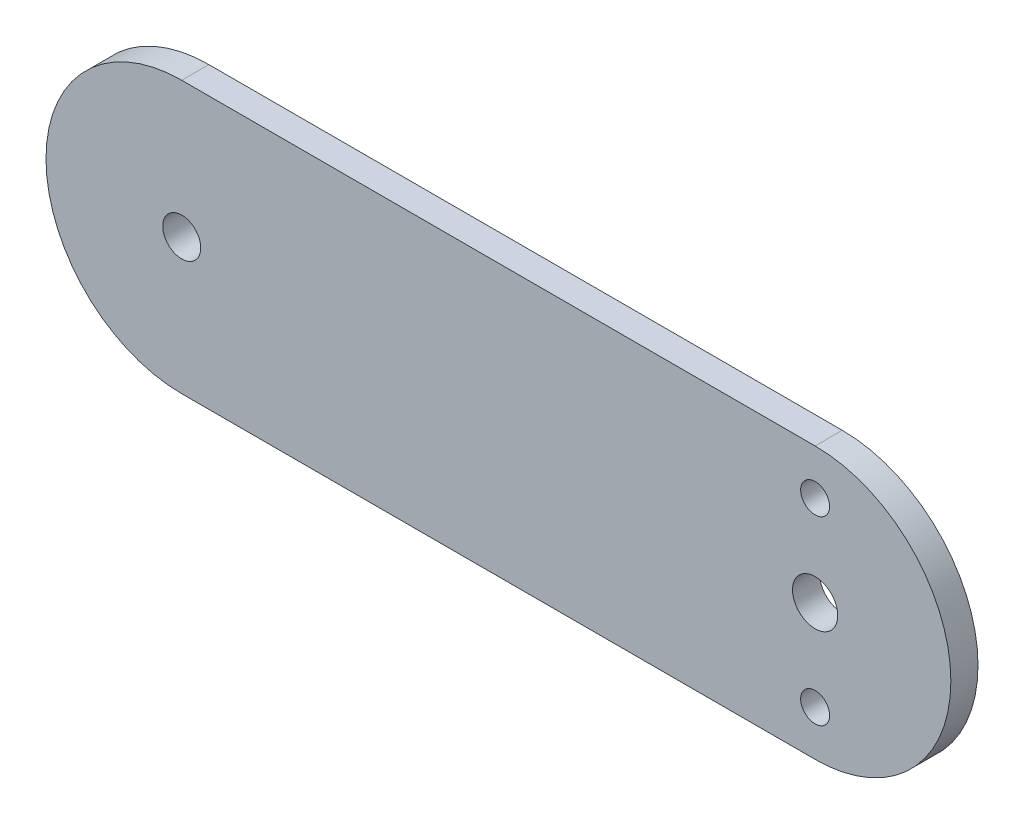
from build123d import *

# Parameters (mm, degrees)
ESQUISSE1_R             = 2.5
ESQUISSE1_R_2           = 2.1
BOSS_EXTRU_1_DEPTH      = 3
ESQUISSE2_R             = 1.6
ENL_V_MAT_EXTRU_1_DEPTH = 53.28766585


with BuildPart() as part:
    # Esquisse1 → Boss.-Extru.1 (new body)
    with BuildSketch(Plane.XY):
        with BuildLine():
            Line((-35, 15), (35, 15))
            ThreePointArc((35, 15), (50, 0), (35, -15))
            Line((35, -15), (-35, -15))
            ThreePointArc((-35, -15), (-50, 0), (-35, 15))
        make_face()
        with Locations((35, 0)):
            Circle(ESQUISSE1_R, mode=Mode.SUBTRACT)
        with Locations((-35, 0)):
            Circle(ESQUISSE1_R_2, mode=Mode.SUBTRACT)
    extrude(amount=BOSS_EXTRU_1_DEPTH)

    # Esquisse2 → Enlèv. mat.-Extru.1 (cut, through all)
    with BuildSketch(Plane.XY.offset(3)):
        with Locations((35, 10)):
            Circle(ESQUISSE2_R)
        with Locations(Location((35, -10, 0), (0, 0, 180))):
            Circle(ESQUISSE2_R)
    extrude(amount=-ENL_V_MAT_EXTRU_1_DEPTH, mode=Mode.SUBTRACT)


solid = part.part
